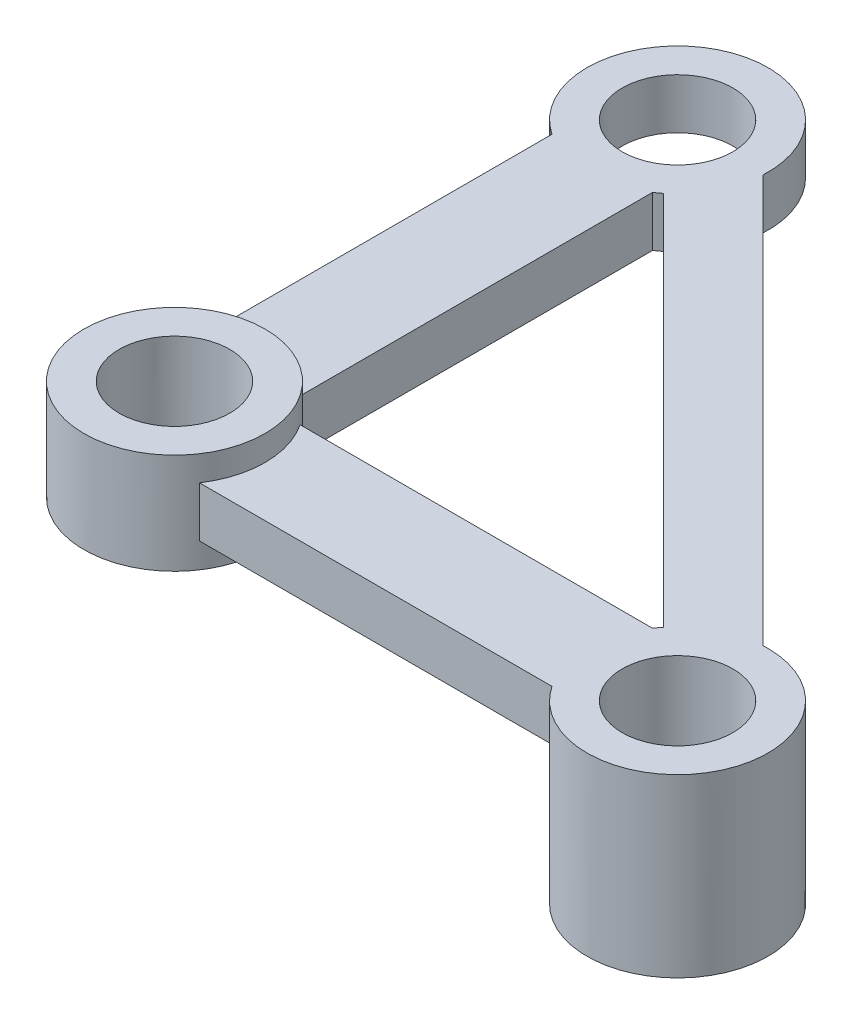
from build123d import *
from build123d.topology import SkipClean

# Parameters (mm, degrees)
BOSS_EXTRUDE1_DEPTH = 5
BOSS_EXTRUDE4_START = 12.5
SKETCH6_R           = 9
BOSS_EXTRUDE4_DEPTH = 12.5
SKETCH2_R           = 5.5
CUT_EXTRUDE1_DEPTH  = 5
BOSS_EXTRUDE2_START = 2.5
SKETCH3_R           = 9
BOSS_EXTRUDE2_DEPTH = 2.5
SKETCH4_R           = 9
BOSS_EXTRUDE3_DEPTH = 2.5
SKETCH5_R           = 5.5
CUT_EXTRUDE2_DEPTH  = 86.802097876
SKETCH7_R           = 5.5
CUT_EXTRUDE3_DEPTH  = 86.254032163


with BuildPart() as part:
    # Sketch1 → Boss-Extrude1 (new body)
    with BuildSketch(Plane(origin=(0, 0, 0), x_dir=(1, 0, 0), z_dir=(0, 1, 0))):
        with BuildLine():
            Line((-5, -7.483314774), (-5, -42.516685226))
            ThreePointArc((-5, -42.516685226), (-6.363961031, -56.363961031), (7.483314774, -55))
            Line((7.483314774, -55), (42.516685226, -55))
            ThreePointArc((42.516685226, -55), (58.052258964, -54.020090244), (49.499224197, -41.013942823))
            Line((49.499224197, -41.013942823), (8.986057177, -0.500775803))
            ThreePointArc((8.986057177, -0.500775803), (-4.020090244, 8.052258964), (-5, -7.483314774))
        make_face()
        with BuildLine():
            Line((5, -7.483314774), (5, -42.516685226))
            ThreePointArc((5, -42.516685226), (6.363961031, -43.636038969), (7.483314774, -45))
            Line((7.483314774, -45), (42.516685226, -45))
            ThreePointArc((42.516685226, -45), (42.735948163, -44.68647472), (42.968337898, -44.382551461))
            Line((42.968337898, -44.382551461), (5.617448539, -7.031662102))
            ThreePointArc((5.617448539, -7.031662102), (5.31352528, -7.264051837), (5, -7.483314774))
        make_face(mode=Mode.SUBTRACT)
    extrude(amount=BOSS_EXTRUDE1_DEPTH)

    # Sketch6 → Boss-Extrude4 (add)
    with SkipClean():  # the faces are left unmerged after this step: merging them gives an invalid solid
        with BuildSketch(Plane.XZ.offset(BOSS_EXTRUDE4_START)):
            with Locations(Location((50, 50, 0), (0, 0, 270))):
                Circle(SKETCH6_R)
        extrude(amount=-BOSS_EXTRUDE4_DEPTH)

    # Sketch2 → Cut-Extrude1 (cut)
    with SkipClean():  # the faces are left unmerged after this step: merging them gives an invalid solid
        with BuildSketch(Plane(origin=(0, 5, 0), x_dir=(1, 0, 0), z_dir=(0, 1, 0))):
            with Locations(Location((0, 0, 0), (0, 0, 270))):
                Circle(SKETCH2_R)
        extrude(amount=-CUT_EXTRUDE1_DEPTH, mode=Mode.SUBTRACT)

    # Sketch3 → Boss-Extrude2 (add)
    with SkipClean():  # the faces are left unmerged after this step: merging them gives an invalid solid
        with BuildSketch(Plane.XZ.offset(BOSS_EXTRUDE2_START)):
            with Locations(Location((0, 50, 0), (0, 0, 270))):
                Circle(SKETCH3_R)
        extrude(amount=-BOSS_EXTRUDE2_DEPTH)

    # Sketch4 → Boss-Extrude3 (add)
    with SkipClean():  # the faces are left unmerged after this step: merging them gives an invalid solid
        with BuildSketch(Plane(origin=(0, 5, 0), x_dir=(1, 0, 0), z_dir=(0, 1, 0))):
            with Locations(Location((0, -50, 0), (0, 0, 90))):
                Circle(SKETCH4_R)
        extrude(amount=BOSS_EXTRUDE3_DEPTH)

    # Sketch5 → Cut-Extrude2 (cut, through all)
    with SkipClean():  # the faces are left unmerged after this step: merging them gives an invalid solid
        with BuildSketch(Plane(origin=(0, 7.5, 0), x_dir=(1, 0, 0), z_dir=(0, 1, 0))):
            with Locations(Location((0, -50, 0), (0, 0, 270))):
                Circle(SKETCH5_R)
        extrude(amount=-CUT_EXTRUDE2_DEPTH, mode=Mode.SUBTRACT)

    # Sketch7 → Cut-Extrude3 (cut, through all)
    with SkipClean():  # the faces are left unmerged after this step: merging them gives an invalid solid
        with BuildSketch(Plane(origin=(0, 5, 0), x_dir=(1, 0, 0), z_dir=(0, 1, 0))):
            with Locations(Location((50, -50, 0), (0, 0, 270))):
                Circle(SKETCH7_R)
        extrude(amount=-CUT_EXTRUDE3_DEPTH, mode=Mode.SUBTRACT)


solid = part.part
